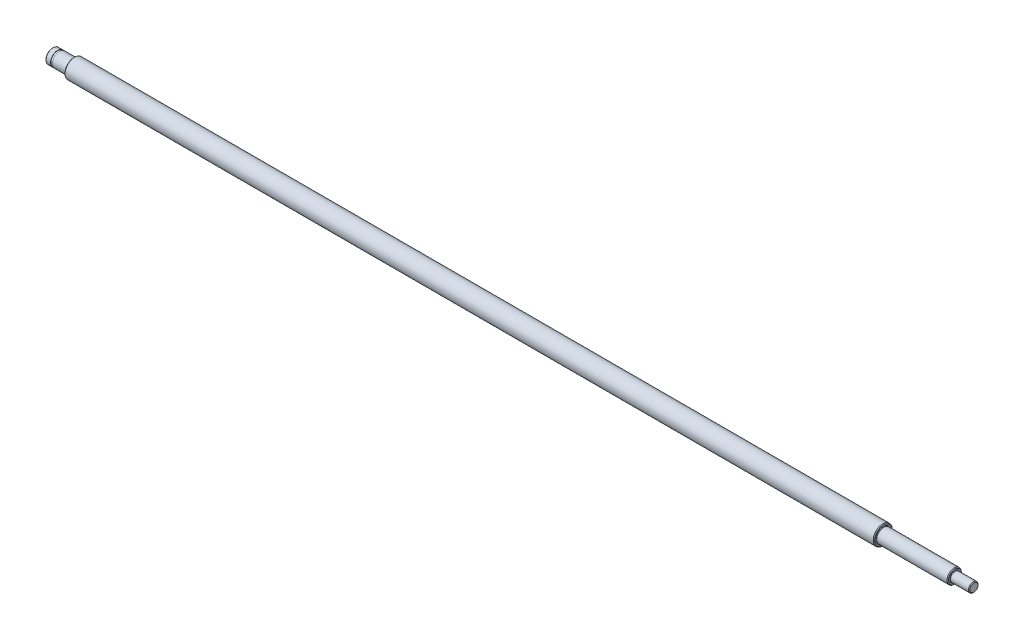
from build123d import *


with BuildPart() as part:
    # 草图1 → 旋转1 (revolve)
    with BuildSketch(Plane(origin=(0, 0, 0), x_dir=(-1, 0, 0), z_dir=(0, 0, -1)), mode=Mode.PRIVATE) as revolve_1_sk:
        with BuildLine():
            Line((-387, 1.7), (-387, 0))
            Line((-387, 0), (0, 0))
            Line((0, 0), (0, 2.7))
            Line((0, 2.7), (-0.3, 3))
            Line((-0.3, 3), (-2.2, 3))
            Line((-2.2, 3), (-2.2, 2.85))
            Line((-2.2, 2.85), (-3, 2.85))
            Line((-3, 2.85), (-3, 3))
            Line((-3, 3), (-8.8, 3))
            ThreePointArc((-8.8, 3), (-8.941421356, 3.058578644), (-9, 3.2))
            Line((-9, 3.2), (-9, 3.7))
            Line((-9, 3.7), (-9.3, 4))
            Line((-9.3, 4), (-348.7, 4))
            Line((-348.7, 4), (-349, 3.7))
            Line((-349, 3.7), (-349, 3.2))
            ThreePointArc((-349, 3.2), (-349.058578644, 3.058578644), (-349.2, 3))
            Line((-349.2, 3), (-378.7, 3))
            Line((-378.7, 3), (-379, 2.7))
            Line((-379, 2.7), (-379, 2.2))
            ThreePointArc((-379, 2.2), (-379.058578644, 2.058578644), (-379.2, 2))
            Line((-379.2, 2), (-386.7, 2))
            Line((-386.7, 2), (-387, 1.7))
        make_face()
    revolve(revolve_1_sk.sketch.rotate(Axis((387, 0, 0), (-1, 0, 0)), 180), axis=Axis((387, 0, 0), (-1, 0, 0)))


solid = part.part
